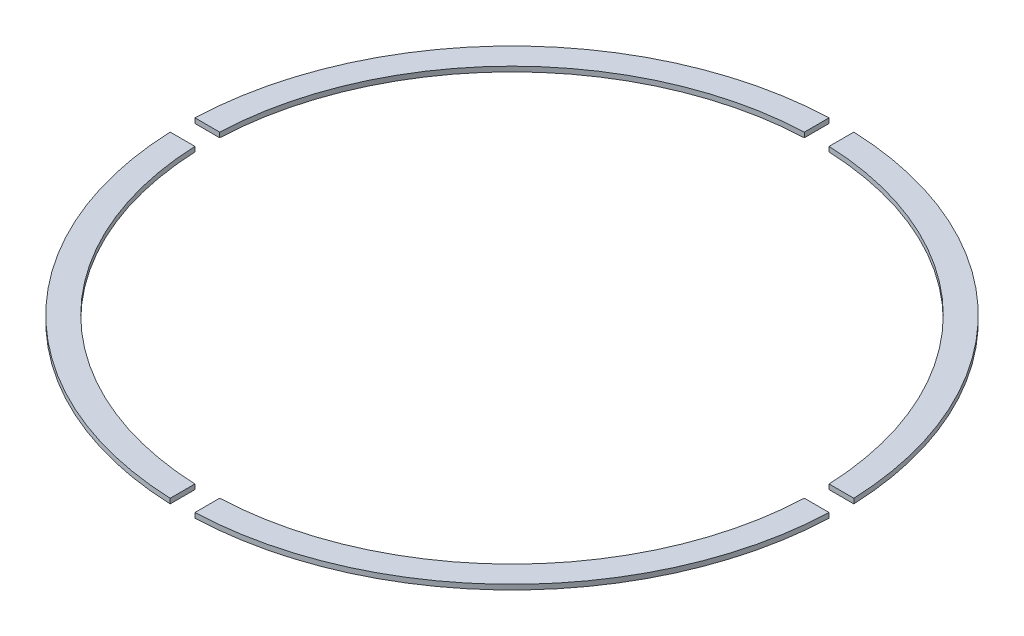
from build123d import *

# Parameters (mm, degrees)
SKETCH1_R           = 200
SKETCH1_R_2         = 185
BOSS_EXTRUDE1_DEPTH = 1.5
SKETCH2_W           = 69.71067633
SKETCH2_H           = 15
CUT_EXTRUDE1_DEPTH  = 283.846689922
CIRPATTERN1_COUNT   = 4


with BuildPart() as part:
    # Sketch1 → Boss-Extrude1 (new, symmetric)
    with BuildSketch(Plane(origin=(0, 0, 0), x_dir=(1, 0, 0), z_dir=(0, 1, 0))):
        Circle(SKETCH1_R)
        Circle(SKETCH1_R_2, mode=Mode.SUBTRACT)
    extrude(amount=BOSS_EXTRUDE1_DEPTH, both=True)

    # Sketch2 → Cut-Extrude1 (cut, symmetric)
    with BuildSketch(Plane(origin=(0, 0, 0), x_dir=(1, 0, 0), z_dir=(0, 1, 0))):
        with Locations((192.5, 0)):
            Rectangle(SKETCH2_W, SKETCH2_H)
    cut_extrude1 = extrude(amount=CUT_EXTRUDE1_DEPTH, both=True, mode=Mode.SUBTRACT)

    # CirPattern1: Cut-Extrude1 ×4 about axis
    cirpattern1_axis = Axis((0, 0, 0), (0, 1, 0))
    for i in range(1, CIRPATTERN1_COUNT):
        add(cut_extrude1.rotate(cirpattern1_axis, i * 360 / CIRPATTERN1_COUNT), mode=Mode.SUBTRACT)


solid = part.part
